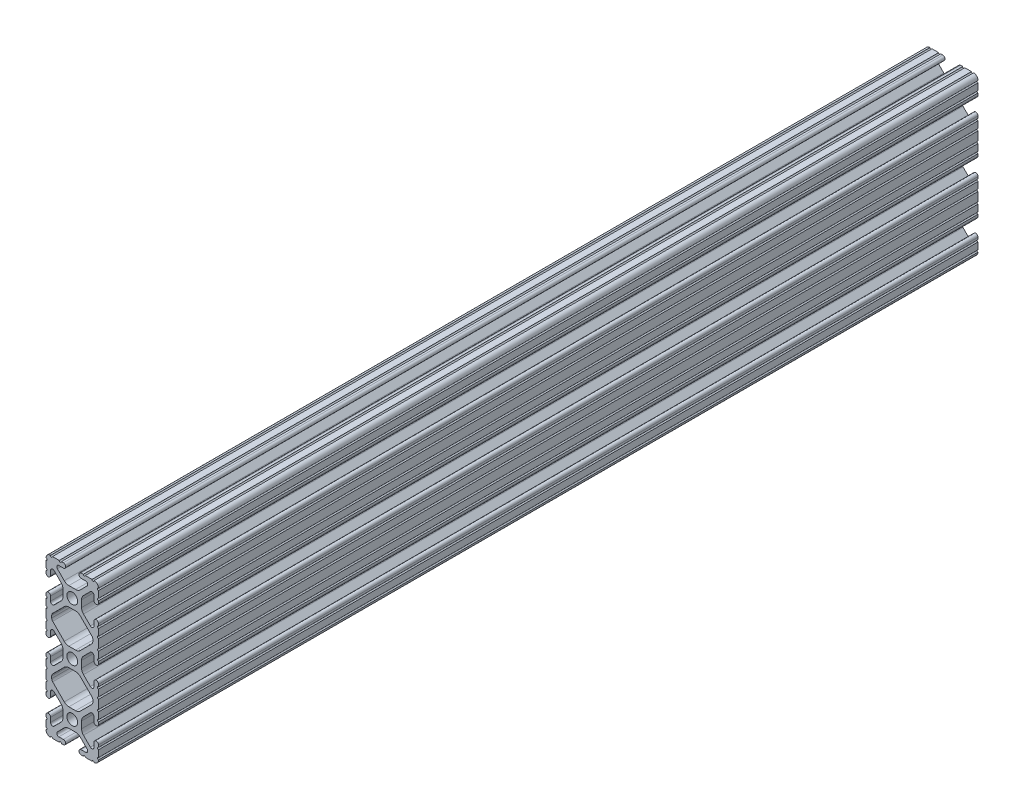
from build123d import *

# Parameters (mm, degrees)
SKETCH1_R           = 2.6035
BOSS_EXTRUDE1_DEPTH = 425.45


with BuildPart() as part:
    # Sketch1 → Boss-Extrude1 (new body)
    with BuildSketch(Plane.XY):
        with BuildLine():
            Line((-6.3246, 38.1), (-9.5504, 38.1))
            ThreePointArc((-9.5504, 38.1), (-10.0584, 37.592), (-10.5664, 38.1))
            ThreePointArc((-10.5664, 38.1), (-12.082677406, 37.482677406), (-12.7, 35.9664))
            ThreePointArc((-12.7, 35.9664), (-12.192, 35.4584), (-12.7, 34.9504))
            Line((-12.7, 34.9504), (-12.7, 31.7246))
            ThreePointArc((-12.7, 31.7246), (-12.192, 31.2166), (-12.7, 30.7086))
            Line((-12.7, 30.7086), (-12.7, 29.702307889))
            ThreePointArc((-12.7, 29.702307889), (-11.5951, 28.597407889), (-10.4902, 29.702307889))
            Line((-10.4902, 29.702307889), (-10.4902, 31.874794456))
            ThreePointArc((-10.4902, 31.874794456), (-9.863006367, 32.813456061), (-8.75577951, 32.593214945))
            Line((-8.75577951, 32.593214945), (-5.43843597, 29.275871405))
            ThreePointArc((-5.43843597, 29.275871405), (-4.750182484, 28.245827272), (-4.5085, 27.030807374))
            Line((-4.5085, 27.030807374), (-4.5085, 23.769192626))
            ThreePointArc((-4.5085, 23.769192626), (-4.750182484, 22.554172728), (-5.43843597, 21.524128595))
            Line((-5.43843597, 21.524128595), (-8.75577951, 18.206785055))
            ThreePointArc((-8.75577951, 18.206785055), (-9.863006367, 17.986543939), (-10.4902, 18.925205544))
            Line((-10.4902, 18.925205544), (-10.4902, 21.097692111))
            ThreePointArc((-10.4902, 21.097692111), (-11.5951, 22.202592111), (-12.7, 21.097692111))
            Line((-12.7, 21.097692111), (-12.7, 20.0914))
            ThreePointArc((-12.7, 20.0914), (-12.192, 19.5834), (-12.7, 19.0754))
            Line((-12.7, 19.0754), (-12.7, 15.8496))
            ThreePointArc((-12.7, 15.8496), (-12.192, 15.3416), (-12.7, 14.8336))
            Line((-12.7, 14.8336), (-12.7, 10.5664))
            ThreePointArc((-12.7, 10.5664), (-12.192, 10.0584), (-12.7, 9.5504))
            Line((-12.7, 9.5504), (-12.7, 6.3246))
            ThreePointArc((-12.7, 6.3246), (-12.192, 5.8166), (-12.7, 5.3086))
            Line((-12.7, 5.3086), (-12.7, 4.302307889))
            ThreePointArc((-12.7, 4.302307889), (-11.5951, 3.197407889), (-10.4902, 4.302307889))
            Line((-10.4902, 4.302307889), (-10.4902, 6.474794456))
            ThreePointArc((-10.4902, 6.474794456), (-9.863006367, 7.413456061), (-8.75577951, 7.193214945))
            Line((-8.75577951, 7.193214945), (-5.43843597, 3.875871405))
            ThreePointArc((-5.43843597, 3.875871405), (-4.750182484, 2.845827272), (-4.5085, 1.630807374))
            Line((-4.5085, 1.630807374), (-4.5085, -1.630807374))
            ThreePointArc((-4.5085, -1.630807374), (-4.750182484, -2.845827272), (-5.43843597, -3.875871405))
            Line((-5.43843597, -3.875871405), (-8.75577951, -7.193214945))
            ThreePointArc((-8.75577951, -7.193214945), (-9.863006367, -7.413456061), (-10.4902, -6.474794456))
            Line((-10.4902, -6.474794456), (-10.4902, -4.302307889))
            ThreePointArc((-10.4902, -4.302307889), (-11.5951, -3.197407889), (-12.7, -4.302307889))
            Line((-12.7, -4.302307889), (-12.7, -5.3086))
            ThreePointArc((-12.7, -5.3086), (-12.192, -5.8166), (-12.7, -6.3246))
            Line((-12.7, -6.3246), (-12.7, -9.5504))
            ThreePointArc((-12.7, -9.5504), (-12.192, -10.0584), (-12.7, -10.5664))
            Line((-12.7, -10.5664), (-12.7, -14.8336))
            ThreePointArc((-12.7, -14.8336), (-12.192, -15.3416), (-12.7, -15.8496))
            Line((-12.7, -15.8496), (-12.7, -19.0754))
            ThreePointArc((-12.7, -19.0754), (-12.192, -19.5834), (-12.7, -20.0914))
            Line((-12.7, -20.0914), (-12.7, -21.097692111))
            ThreePointArc((-12.7, -21.097692111), (-11.5951, -22.202592111), (-10.4902, -21.097692111))
            Line((-10.4902, -21.097692111), (-10.4902, -18.925205544))
            ThreePointArc((-10.4902, -18.925205544), (-9.863006367, -17.986543939), (-8.75577951, -18.206785055))
            Line((-8.75577951, -18.206785055), (-5.43843597, -21.524128595))
            ThreePointArc((-5.43843597, -21.524128595), (-4.750182484, -22.554172728), (-4.5085, -23.769192626))
            Line((-4.5085, -23.769192626), (-4.5085, -27.030807374))
            ThreePointArc((-4.5085, -27.030807374), (-4.750182484, -28.245827272), (-5.43843597, -29.275871405))
            Line((-5.43843597, -29.275871405), (-8.75577951, -32.593214945))
            ThreePointArc((-8.75577951, -32.593214945), (-9.863006367, -32.813456061), (-10.4902, -31.874794456))
            Line((-10.4902, -31.874794456), (-10.4902, -29.702307889))
            ThreePointArc((-10.4902, -29.702307889), (-11.5951, -28.597407889), (-12.7, -29.702307889))
            Line((-12.7, -29.702307889), (-12.7, -30.7086))
            ThreePointArc((-12.7, -30.7086), (-12.192, -31.2166), (-12.7, -31.7246))
            Line((-12.7, -31.7246), (-12.7, -34.9504))
            ThreePointArc((-12.7, -34.9504), (-12.192, -35.4584), (-12.7, -35.9664))
            ThreePointArc((-12.7, -35.9664), (-12.082677406, -37.482677406), (-10.5664, -38.1))
            ThreePointArc((-10.5664, -38.1), (-10.0584, -37.592), (-9.5504, -38.1))
            Line((-9.5504, -38.1), (-6.3246, -38.1))
            ThreePointArc((-6.3246, -38.1), (-5.8166, -37.592), (-5.3086, -38.1))
            Line((-5.3086, -38.1), (-4.302307889, -38.1))
            ThreePointArc((-4.302307889, -38.1), (-3.197407889, -36.9951), (-4.302307889, -35.8902))
            Line((-4.302307889, -35.8902), (-6.474794456, -35.8902))
            ThreePointArc((-6.474794456, -35.8902), (-7.413456061, -35.263006367), (-7.193214945, -34.15577951))
            Line((-7.193214945, -34.15577951), (-3.875871405, -30.83843597))
            ThreePointArc((-3.875871405, -30.83843597), (-2.845827272, -30.150182484), (-1.630807374, -29.9085))
            Line((-1.630807374, -29.9085), (1.630807374, -29.9085))
            ThreePointArc((1.630807374, -29.9085), (2.845827272, -30.150182484), (3.875871405, -30.83843597))
            Line((3.875871405, -30.83843597), (7.193214945, -34.15577951))
            ThreePointArc((7.193214945, -34.15577951), (7.413456061, -35.263006367), (6.474794456, -35.8902))
            Line((6.474794456, -35.8902), (4.302307889, -35.8902))
            ThreePointArc((4.302307889, -35.8902), (3.197407889, -36.9951), (4.302307889, -38.1))
            Line((4.302307889, -38.1), (5.3086, -38.1))
            ThreePointArc((5.3086, -38.1), (5.8166, -37.592), (6.3246, -38.1))
            Line((6.3246, -38.1), (9.5504, -38.1))
            ThreePointArc((9.5504, -38.1), (10.0584, -37.592), (10.5664, -38.1))
            ThreePointArc((10.5664, -38.1), (12.082677406, -37.482677406), (12.7, -35.9664))
            ThreePointArc((12.7, -35.9664), (12.192, -35.4584), (12.7, -34.9504))
            Line((12.7, -34.9504), (12.7, -31.7246))
            ThreePointArc((12.7, -31.7246), (12.192, -31.2166), (12.7, -30.7086))
            Line((12.7, -30.7086), (12.7, -29.702307918))
            ThreePointArc((12.7, -29.702307918), (11.5951, -28.597407918), (10.4902, -29.702307918))
            Line((10.4902, -29.702307918), (10.4902, -31.874794456))
            ThreePointArc((10.4902, -31.874794456), (9.863006367, -32.813456061), (8.75577951, -32.593214945))
            Line((8.75577951, -32.593214945), (5.43843597, -29.275871405))
            ThreePointArc((5.43843597, -29.275871405), (4.750182484, -28.245827272), (4.5085, -27.030807374))
            Line((4.5085, -27.030807374), (4.5085, -23.769192626))
            ThreePointArc((4.5085, -23.769192626), (4.750182484, -22.554172728), (5.43843597, -21.524128595))
            Line((5.43843597, -21.524128595), (8.75577951, -18.206785055))
            ThreePointArc((8.75577951, -18.206785055), (9.863006367, -17.986543939), (10.4902, -18.925205544))
            Line((10.4902, -18.925205544), (10.4902, -21.097692058))
            ThreePointArc((10.4902, -21.097692058), (11.5951, -22.202592058), (12.7, -21.097692058))
            Line((12.7, -21.097692058), (12.7, -20.0914))
            ThreePointArc((12.7, -20.0914), (12.192, -19.5834), (12.7, -19.0754))
            Line((12.7, -19.0754), (12.7, -15.8496))
            ThreePointArc((12.7, -15.8496), (12.192, -15.3416), (12.7, -14.8336))
            Line((12.7, -14.8336), (12.7, -10.5664))
            ThreePointArc((12.7, -10.5664), (12.192, -10.0584), (12.7, -9.5504))
            Line((12.7, -9.5504), (12.7, -6.3246))
            ThreePointArc((12.7, -6.3246), (12.192, -5.8166), (12.7, -5.3086))
            Line((12.7, -5.3086), (12.7, -4.302307889))
            ThreePointArc((12.7, -4.302307889), (11.5951, -3.197407889), (10.4902, -4.302307889))
            Line((10.4902, -4.302307889), (10.4902, -6.474794456))
            ThreePointArc((10.4902, -6.474794456), (9.863006367, -7.413456061), (8.75577951, -7.193214945))
            Line((8.75577951, -7.193214945), (5.43843597, -3.875871405))
            ThreePointArc((5.43843597, -3.875871405), (4.750182484, -2.845827272), (4.5085, -1.630807374))
            Line((4.5085, -1.630807374), (4.5085, 1.630807374))
            ThreePointArc((4.5085, 1.630807374), (4.750182484, 2.845827272), (5.43843597, 3.875871405))
            Line((5.43843597, 3.875871405), (8.75577951, 7.193214945))
            ThreePointArc((8.75577951, 7.193214945), (9.863006367, 7.413456061), (10.4902, 6.474794456))
            Line((10.4902, 6.474794456), (10.4902, 4.302307889))
            ThreePointArc((10.4902, 4.302307889), (11.5951, 3.197407889), (12.7, 4.302307889))
            Line((12.7, 4.302307889), (12.7, 5.3086))
            ThreePointArc((12.7, 5.3086), (12.192, 5.8166), (12.7, 6.3246))
            Line((12.7, 6.3246), (12.7, 9.5504))
            ThreePointArc((12.7, 9.5504), (12.192, 10.0584), (12.7, 10.5664))
            Line((12.7, 10.5664), (12.7, 14.8336))
            ThreePointArc((12.7, 14.8336), (12.192, 15.3416), (12.7, 15.8496))
            Line((12.7, 15.8496), (12.7, 19.0754))
            ThreePointArc((12.7, 19.0754), (12.192, 19.5834), (12.7, 20.0914))
            Line((12.7, 20.0914), (12.7, 21.097692082))
            ThreePointArc((12.7, 21.097692082), (11.5951, 22.202592082), (10.4902, 21.097692082))
            Line((10.4902, 21.097692082), (10.4902, 18.925205544))
            ThreePointArc((10.4902, 18.925205544), (9.863006367, 17.986543939), (8.75577951, 18.206785055))
            Line((8.75577951, 18.206785055), (5.43843597, 21.524128595))
            ThreePointArc((5.43843597, 21.524128595), (4.750182484, 22.554172728), (4.5085, 23.769192626))
            Line((4.5085, 23.769192626), (4.5085, 27.030807374))
            ThreePointArc((4.5085, 27.030807374), (4.750182484, 28.245827272), (5.43843597, 29.275871405))
            Line((5.43843597, 29.275871405), (8.75577951, 32.593214945))
            ThreePointArc((8.75577951, 32.593214945), (9.863006367, 32.813456061), (10.4902, 31.874794456))
            Line((10.4902, 31.874794456), (10.4902, 29.702307889))
            ThreePointArc((10.4902, 29.702307889), (11.5951, 28.597407889), (12.7, 29.702307889))
            Line((12.7, 29.702307889), (12.7, 30.7086))
            ThreePointArc((12.7, 30.7086), (12.192, 31.2166), (12.7, 31.7246))
            Line((12.7, 31.7246), (12.7, 34.9504))
            ThreePointArc((12.7, 34.9504), (12.192, 35.4584), (12.7, 35.9664))
            ThreePointArc((12.7, 35.9664), (12.082677406, 37.482677406), (10.5664, 38.1))
            ThreePointArc((10.5664, 38.1), (10.0584, 37.592), (9.5504, 38.1))
            Line((9.5504, 38.1), (6.3246, 38.1))
            ThreePointArc((6.3246, 38.1), (5.8166, 37.592), (5.3086, 38.1))
            Line((5.3086, 38.1), (4.302307889, 38.1))
            ThreePointArc((4.302307889, 38.1), (3.197407889, 36.9951), (4.302307889, 35.8902))
            Line((4.302307889, 35.8902), (6.474794456, 35.8902))
            ThreePointArc((6.474794456, 35.8902), (7.413456061, 35.263006367), (7.193214945, 34.15577951))
            Line((7.193214945, 34.15577951), (3.875871405, 30.83843597))
            ThreePointArc((3.875871405, 30.83843597), (2.845827272, 30.150182484), (1.630807374, 29.9085))
            Line((1.630807374, 29.9085), (-1.630807374, 29.9085))
            ThreePointArc((-1.630807374, 29.9085), (-2.845827272, 30.150182484), (-3.875871405, 30.83843597))
            Line((-3.875871405, 30.83843597), (-7.193214945, 34.15577951))
            ThreePointArc((-7.193214945, 34.15577951), (-7.413456061, 35.263006367), (-6.474794456, 35.8902))
            Line((-6.474794456, 35.8902), (-4.302307889, 35.8902))
            ThreePointArc((-4.302307889, 35.8902), (-3.197407889, 36.9951), (-4.302307889, 38.1))
            Line((-4.302307889, 38.1), (-5.3086, 38.1))
            ThreePointArc((-5.3086, 38.1), (-5.8166, 37.592), (-6.3246, 38.1))
        make_face()
        with Locations(Location((0, 25.4, 0), (0, 0, 180))):
            Circle(SKETCH1_R, mode=Mode.SUBTRACT)
        with Locations(Location((0, -25.4, 0), (0, 0, 180))):
            Circle(SKETCH1_R, mode=Mode.SUBTRACT)
        with Locations(Location((0, 0, 0), (0, 0, 180))):
            Circle(SKETCH1_R, mode=Mode.SUBTRACT)
        with BuildLine():
            Line((-9.9314, 12.146268083), (-9.9314, 13.253731917))
            ThreePointArc((-9.9314, 13.253731917), (-9.811525488, 13.856381786), (-9.470151759, 14.367283676))
            Line((-9.470151759, 14.367283676), (-3.875871405, 19.96156403))
            ThreePointArc((-3.875871405, 19.96156403), (-2.845827272, 20.649817516), (-1.630807374, 20.8915))
            Line((-1.630807374, 20.8915), (1.630807374, 20.8915))
            ThreePointArc((1.630807374, 20.8915), (2.845827272, 20.649817516), (3.875871405, 19.96156403))
            Line((3.875871405, 19.96156403), (9.470151759, 14.367283676))
            ThreePointArc((9.470151759, 14.367283676), (9.811525488, 13.856381786), (9.9314, 13.253731917))
            Line((9.9314, 13.253731917), (9.9314, 12.146268083))
            ThreePointArc((9.9314, 12.146268083), (9.811525488, 11.543618214), (9.470151759, 11.032716324))
            Line((9.470151759, 11.032716324), (3.875871405, 5.43843597))
            ThreePointArc((3.875871405, 5.43843597), (2.845827272, 4.750182484), (1.630807374, 4.5085))
            Line((1.630807374, 4.5085), (-1.630807374, 4.5085))
            ThreePointArc((-1.630807374, 4.5085), (-2.845827272, 4.750182484), (-3.875871405, 5.43843597))
            Line((-3.875871405, 5.43843597), (-9.470151759, 11.032716324))
            ThreePointArc((-9.470151759, 11.032716324), (-9.811525488, 11.543618214), (-9.9314, 12.146268083))
        make_face(mode=Mode.SUBTRACT)
        with BuildLine():
            Line((-9.9314, -13.253731917), (-9.9314, -12.146268083))
            ThreePointArc((-9.9314, -12.146268083), (-9.811525488, -11.543618214), (-9.470151759, -11.032716324))
            Line((-9.470151759, -11.032716324), (-3.875871405, -5.43843597))
            ThreePointArc((-3.875871405, -5.43843597), (-2.845827272, -4.750182484), (-1.630807374, -4.5085))
            Line((-1.630807374, -4.5085), (1.630807374, -4.5085))
            ThreePointArc((1.630807374, -4.5085), (2.845827272, -4.750182484), (3.875871405, -5.43843597))
            Line((3.875871405, -5.43843597), (9.470151759, -11.032716324))
            ThreePointArc((9.470151759, -11.032716324), (9.811525488, -11.543618214), (9.9314, -12.146268083))
            Line((9.9314, -12.146268083), (9.9314, -13.253731917))
            ThreePointArc((9.9314, -13.253731917), (9.811525488, -13.856381786), (9.470151759, -14.367283676))
            Line((9.470151759, -14.367283676), (3.875871405, -19.96156403))
            ThreePointArc((3.875871405, -19.96156403), (2.845827272, -20.649817516), (1.630807374, -20.8915))
            Line((1.630807374, -20.8915), (-1.630807374, -20.8915))
            ThreePointArc((-1.630807374, -20.8915), (-2.845827272, -20.649817516), (-3.875871405, -19.96156403))
            Line((-3.875871405, -19.96156403), (-9.470151759, -14.367283676))
            ThreePointArc((-9.470151759, -14.367283676), (-9.811525488, -13.856381786), (-9.9314, -13.253731917))
        make_face(mode=Mode.SUBTRACT)
    extrude(amount=-BOSS_EXTRUDE1_DEPTH)


solid = part.part
